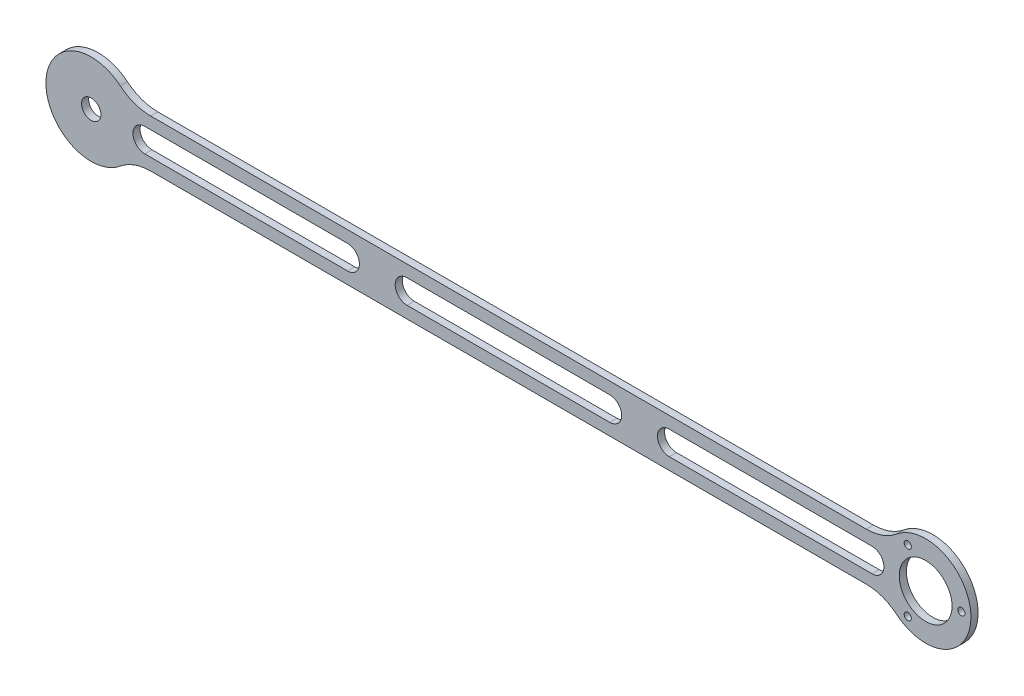
from build123d import *

# Parameters (mm, degrees)
SKETCH1_R               = 4.075
SKETCH1_R_2             = 11.075
BOSS_EXTRUDE1_DEPTH     = 1.5
CUT_EXTRUDE2_DEPTH      = 370.491880831
CUT_EXTRUDE2_DEPTH_BACK = 370.491880831
SKETCH3_R               = 1.5
CUT_EXTRUDE3_DEPTH      = 370.491880831
CUT_EXTRUDE3_DEPTH_BACK = 370.491880831


with BuildPart() as part:
    # Sketch1 → Boss-Extrude1 (new, symmetric)
    with BuildSketch(Plane.XY):
        with BuildLine():
            Line((24.919871589, 10), (325.080128411, 10))
            ThreePointArc((325.080128411, 10), (331.873790616, 11.189201137), (337.859549739, 14.615384615))
            ThreePointArc((337.859549739, 14.615384615), (343.546020905, 17.870258919), (350, 19))
            ThreePointArc((350, 19), (369, 0), (350, -19))
            ThreePointArc((350, -19), (343.546020905, -17.870258919), (337.859549739, -14.615384615))
            ThreePointArc((337.859549739, -14.615384615), (331.873790616, -11.189201137), (325.080128411, -10))
            Line((325.080128411, -10), (24.919871589, -10))
            ThreePointArc((24.919871589, -10), (18.126209384, -11.189201137), (12.140450261, -14.615384615))
            ThreePointArc((12.140450261, -14.615384615), (6.453979095, -17.870258919), (0, -19))
            ThreePointArc((0, -19), (-19, 0), (0, 19))
            ThreePointArc((0, 19), (6.453979095, 17.870258919), (12.140450261, 14.615384615))
            ThreePointArc((12.140450261, 14.615384615), (18.126209384, 11.189201137), (24.919871589, 10))
        make_face()
        Circle(SKETCH1_R, mode=Mode.SUBTRACT)
        with Locations((350, 0)):
            Circle(SKETCH1_R_2, mode=Mode.SUBTRACT)
    extrude(amount=BOSS_EXTRUDE1_DEPTH, both=True)

    # Sketch3 → Cut-Extrude2 (cut, two sides: drawn at the far end of the back side and taken through both)
    with BuildSketch(Plane.XY.offset(-CUT_EXTRUDE2_DEPTH_BACK)):
        with Locations((365, 0)):
            Circle(SKETCH3_R)
        with Locations((342.5, -12.990381057)):
            Circle(SKETCH3_R)
        with Locations((342.5, 12.990381057)):
            Circle(SKETCH3_R)
    extrude(amount=CUT_EXTRUDE2_DEPTH + CUT_EXTRUDE2_DEPTH_BACK, mode=Mode.SUBTRACT)

    # Sketch4 → Cut-Extrude3 (cut, two sides: drawn at the far end of the back side and taken through both)
    with BuildSketch(Plane.XY.offset(-CUT_EXTRUDE3_DEPTH_BACK)):
        with BuildLine():
            Line((22.5, 5), (107.5, 5))
            ThreePointArc((107.5, 5), (112.5, 0), (107.5, -5))
            Line((107.5, -5), (22.5, -5))
            ThreePointArc((22.5, -5), (17.5, 0), (22.5, 5))
        make_face()
        with BuildLine():
            Line((132.5, 5), (217.5, 5))
            ThreePointArc((217.5, 5), (222.5, 0), (217.5, -5))
            Line((217.5, -5), (132.5, -5))
            ThreePointArc((132.5, -5), (127.5, 0), (132.5, 5))
        make_face()
        with BuildLine():
            Line((242.5, 5), (327.5, 5))
            ThreePointArc((327.5, 5), (332.5, 0), (327.5, -5))
            Line((327.5, -5), (242.5, -5))
            ThreePointArc((242.5, -5), (237.5, 0), (242.5, 5))
        make_face()
    extrude(amount=CUT_EXTRUDE3_DEPTH + CUT_EXTRUDE3_DEPTH_BACK, mode=Mode.SUBTRACT)


solid = part.part
